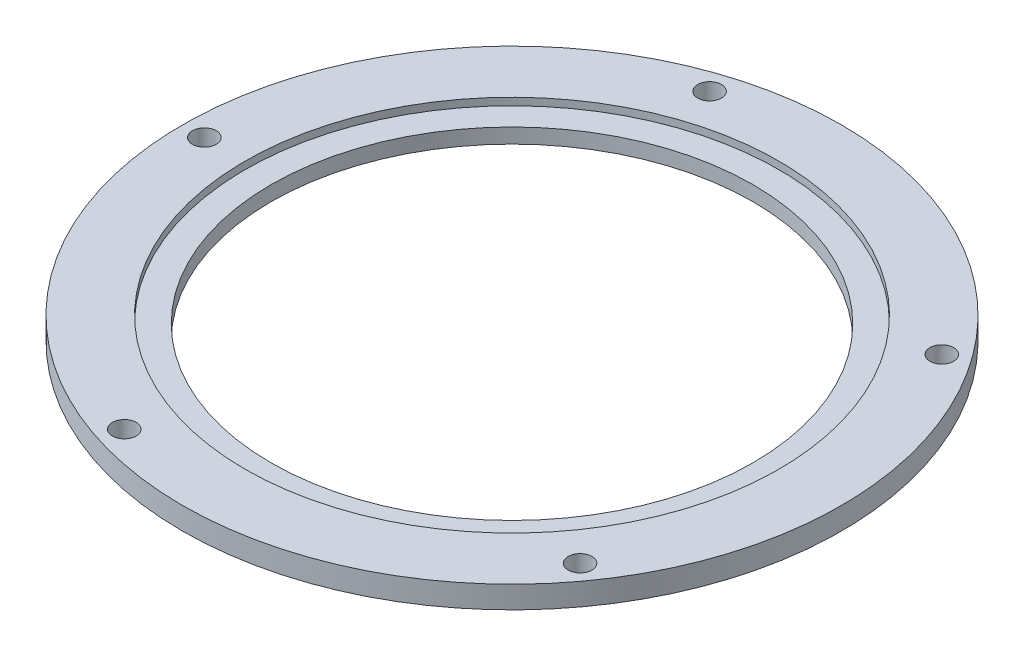
from build123d import *

# Parameters (mm, degrees)
SKETCH1_R            = 44.45
SKETCH1_R_2          = 36
BOSS_EXTRUDE1_DEPTH  = 3
SKETCH1_3_R          = 36
SKETCH1_3_R_2        = 32.5
BOSS_EXTRUDE2_DEPTH  = 2
M3_CLEARANCE_HOLE1_D = 3.2
CIRPATTERN1_COUNT    = 5


with BuildPart() as part:
    # Sketch1 → Boss-Extrude1 (new body)
    with BuildSketch(Plane(origin=(0, 0, 0), x_dir=(1, 0, 0), z_dir=(0, 1, 0))):
        Circle(SKETCH1_R)
        Circle(SKETCH1_R_2, mode=Mode.SUBTRACT)
    extrude(amount=BOSS_EXTRUDE1_DEPTH)

    # Sketch1<3> → Boss-Extrude2 (add)
    with BuildSketch(Plane(origin=(0, 0, 0), x_dir=(1, 0, 0), z_dir=(0, 1, 0))):
        Circle(SKETCH1_3_R)
        Circle(SKETCH1_3_R_2, mode=Mode.SUBTRACT)
    extrude(amount=BOSS_EXTRUDE2_DEPTH)

    # M3 Clearance Hole1 (through all)
    with Locations(Plane(origin=(0, 3, 0), x_dir=(1, 0, 0), z_dir=(0, 1, 0))):
        with Locations((-41.5, 0)):
            m3_clearance_hole1 = Hole(M3_CLEARANCE_HOLE1_D / 2)

    # CirPattern1: M3 Clearance Hole1 ×5 about axis
    cirpattern1_axis = Axis((0, 3, 0), (0, -1, 0))
    for i in range(1, CIRPATTERN1_COUNT):
        add(m3_clearance_hole1.rotate(cirpattern1_axis, i * 360 / CIRPATTERN1_COUNT), mode=Mode.SUBTRACT)


solid = part.part
